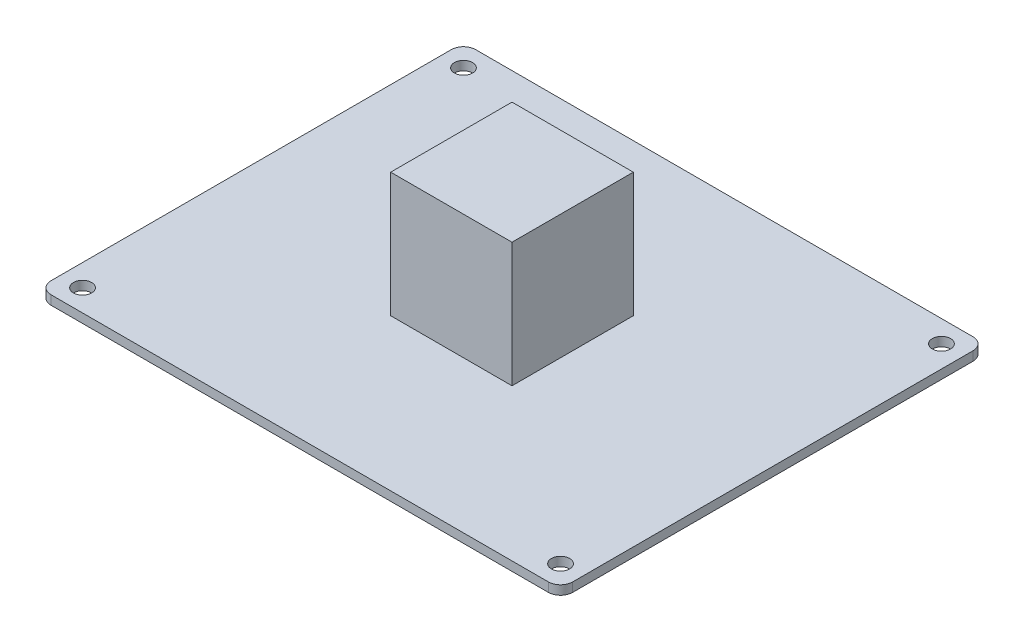
from build123d import *

# Parameters (mm, degrees)
SKETCH1_W             = 86
SKETCH1_H             = 70
BOSS_EXTRUDE1_DEPTH   = 1.5
FILLET1_R             = 2
SKETCH2_W             = 20
SKETCH2_H             = 20
BOSS_EXTRUDE2_DEPTH   = 22
F_1_0MM_DOWEL_HOLE1_D = 3


with BuildPart() as part:
    # Sketch1 → Boss-Extrude1 (new body)
    with BuildSketch(Plane(origin=(0, 0, 0), x_dir=(1, 0, 0), z_dir=(0, 1, 0))):
        Rectangle(SKETCH1_W, SKETCH1_H)
    extrude(amount=BOSS_EXTRUDE1_DEPTH)

    # Fillet1
    fillet1_edges = [part.edges().sort_by_distance(p)[0] for p in [
        (43, 0.75, 35),
        (-43, 0.75, 35),
        (-43, 0.75, -35),
        (43, 0.75, -35),
    ]]
    fillet(fillet1_edges, radius=FILLET1_R)

    # Sketch2 → Boss-Extrude2 (add)
    with BuildSketch(Plane.XZ):
        Rectangle(SKETCH2_W, SKETCH2_H)
    extrude(amount=-BOSS_EXTRUDE2_DEPTH)

    # Ø1.0mm Dowel Hole1 (through all)
    with Locations(Plane(origin=(-39.4, 1.5, -31.4), x_dir=(0, 0, 1), z_dir=(0, 1, 0))):
        with Locations((0, 0), (0, 78.8), (62.8, 0), (62.8, 78.8)):
            Hole(F_1_0MM_DOWEL_HOLE1_D / 2)


solid = part.part
